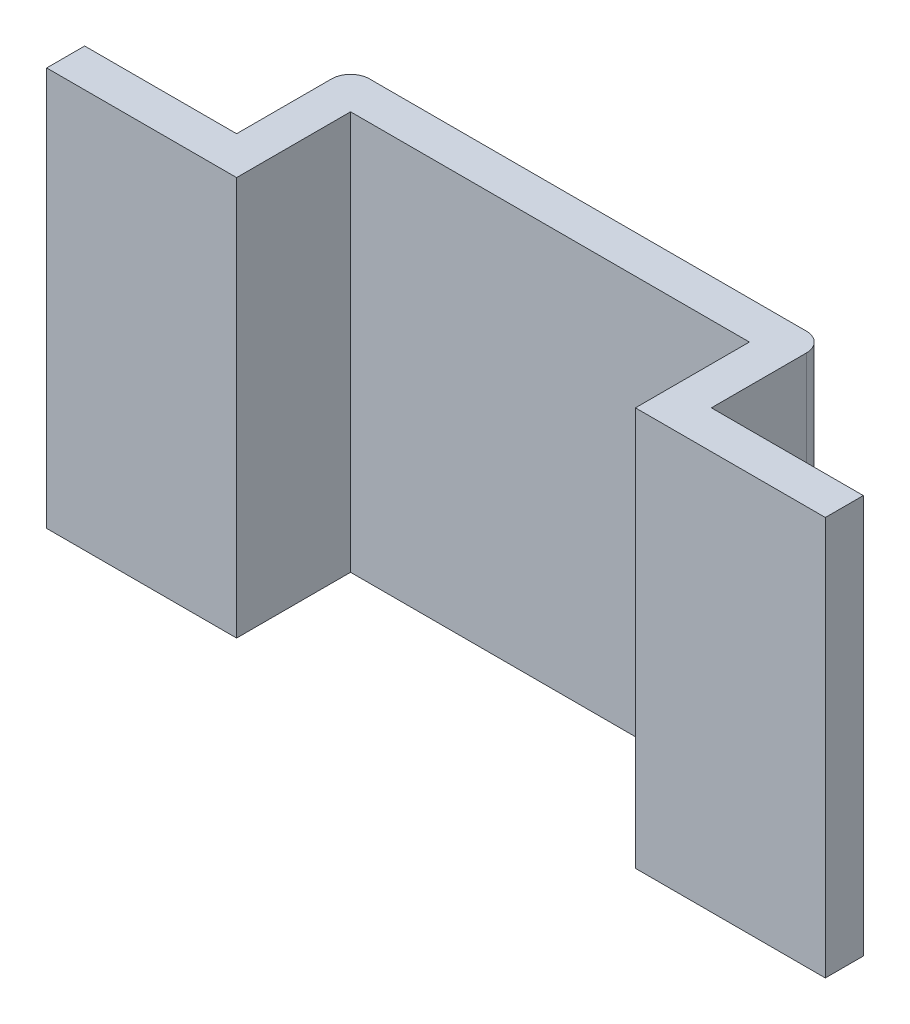
from build123d import *

# Parameters (mm, degrees)
BOSS_EXTRUDE1_DEPTH = 21
FILLET1_R           = 1


with BuildPart() as part:
    # Sketch1 → Boss-Extrude1 (new body)
    with BuildSketch(Plane(origin=(0, 0, 0), x_dir=(1, 0, 0), z_dir=(0, 1, 0))):
        Polygon((-10.5, 0), (-20.5, 0), (-20.5, 2), (-12.5, 2), (-12.5, 8), (12.5, 8), (12.5, 2), (20.5, 2), (20.5, 0), (10.5, 0), (10.5, 6), (-10.5, 6), align=None)
    extrude(amount=BOSS_EXTRUDE1_DEPTH)

    # Fillet1
    fillet1_edges = [part.edges().sort_by_distance(p)[0] for p in [
        (-12.5, 10.5, -8),
        (12.5, 10.5, -8),
    ]]
    fillet(fillet1_edges, radius=FILLET1_R)


solid = part.part
